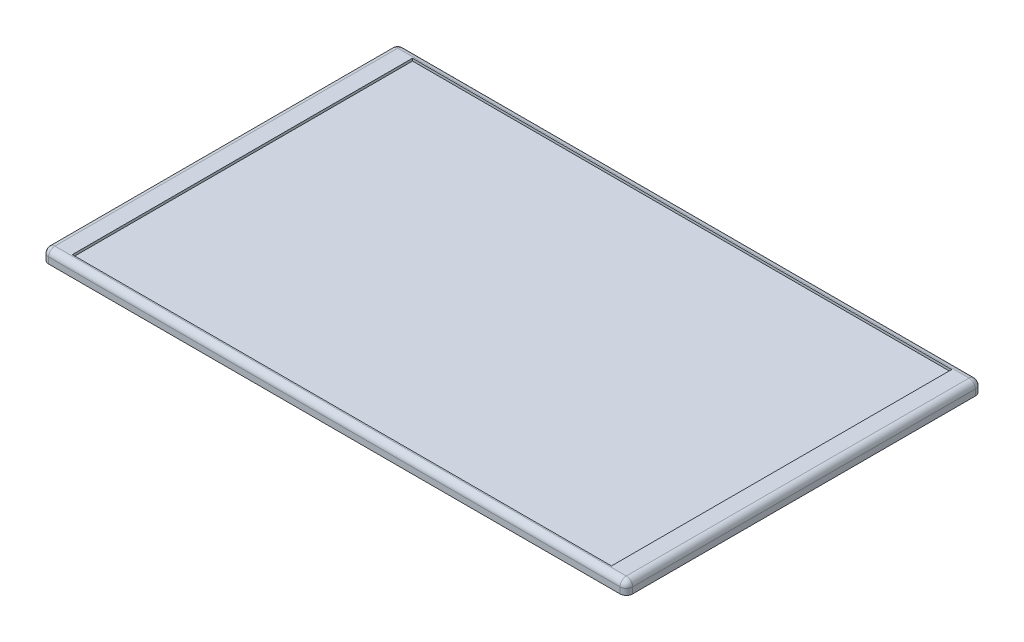
from build123d import *

# Parameters (mm, degrees)
SKETCH1_W           = 235
SKETCH1_H           = 143
BOSS_EXTRUDE1_DEPTH = 5
SKETCH2_W           = 216.96
SKETCH2_H           = 136.898246884
CUT_EXTRUDE1_DEPTH  = 1
FILLET1_R           = 2.54


with BuildPart() as part:
    # Sketch1 → Boss-Extrude1 (new body)
    with BuildSketch(Plane(origin=(0, 0, 0), x_dir=(1, 0, 0), z_dir=(0, 1, 0))):
        with Locations((117.5, 71.5)):
            Rectangle(SKETCH1_W, SKETCH1_H)
    extrude(amount=BOSS_EXTRUDE1_DEPTH)

    # Sketch2 → Cut-Extrude1 (cut)
    with BuildSketch(Plane(origin=(0, 5, 0), x_dir=(1, 0, 0), z_dir=(0, 1, 0))):
        with Locations((117.5, 71.5)):
            Rectangle(SKETCH2_W, SKETCH2_H)
    extrude(amount=-CUT_EXTRUDE1_DEPTH, mode=Mode.SUBTRACT)

    # Fillet1
    fillet1_edges = [part.edges().sort_by_distance(p)[0] for p in [
        (235, 5, -71.5),
        (117.5, 5, -143),
        (0, 5, -71.5),
        (0, 2.5, -143),
        (235, 2.5, -143),
        (235, 2.5, 0),
        (0, 2.5, 0),
        (117.5, 5, 0),
    ]]
    fillet(fillet1_edges, radius=FILLET1_R)


solid = part.part
